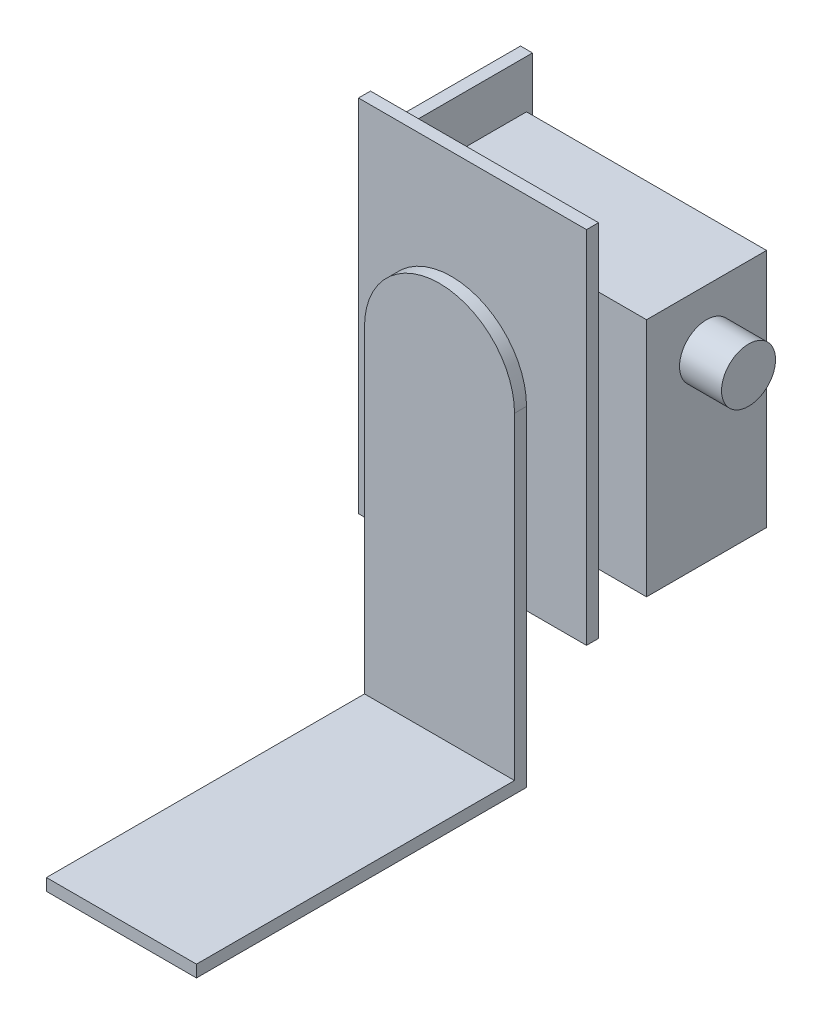
from build123d import *

# Parameters (mm, degrees)
ESQUISSE1_W        = 25
ESQUISSE1_H        = 55
BOSS_EXTRU_1_DEPTH = 2
ESQUISSE2_W        = 25
ESQUISSE2_H        = 2
BOSS_EXTRU_2_DEPTH = 53
BOSS_EXTRU_3_DEPTH = 2
ESQUISSE6_W        = 38
ESQUISSE6_H        = 60
BOSS_EXTRU_4_DEPTH = 2
ESQUISSE7_W        = 40
ESQUISSE7_H        = 40
BOSS_EXTRU_5_DEPTH = 20
ESQUISSE9_W        = 2
ESQUISSE9_H        = 40
BOSS_EXTRU_6_DEPTH = 25
ESQUISSE8_R        = 4.5
BOSS_EXTRU_7_DEPTH = 7


with BuildPart() as part:
    # Esquisse1 → Boss.-Extru.1 (new body)
    with BuildSketch(Plane(origin=(0, 0, 0), x_dir=(1, 0, 0), z_dir=(0, 1, 0))):
        with Locations((12.5, 27.5)):
            Rectangle(ESQUISSE1_W, ESQUISSE1_H)
    extrude(amount=BOSS_EXTRU_1_DEPTH)

    # Esquisse2 → Boss.-Extru.2 (add)
    with BuildSketch(Plane(origin=(0, 2, 0), x_dir=(1, 0, 0), z_dir=(0, 1, 0))):
        with Locations((12.5, 54)):
            Rectangle(ESQUISSE2_W, ESQUISSE2_H)
    extrude(amount=BOSS_EXTRU_2_DEPTH)

    # Esquisse3 → Boss.-Extru.3 (add)
    with BuildSketch(Plane.XY.offset(-53)):
        with BuildLine():
            Line((0, 2), (25, 2))
            Line((25, 2), (25, 55))
            ThreePointArc((25, 55), (12.5, 67.5), (0, 55))
            Line((0, 55), (0, 2))
        make_face()
    extrude(amount=-BOSS_EXTRU_3_DEPTH)

    # Esquisse6 → Boss.-Extru.4 (add)
    with BuildSketch(Plane(origin=(0, 0, -55), x_dir=(-1, 0, 0), z_dir=(0, 0, -1))):
        with Locations((-16, 55.5)):
            Rectangle(ESQUISSE6_W, ESQUISSE6_H)
    extrude(amount=BOSS_EXTRU_4_DEPTH)

    # Esquisse7 → Boss.-Extru.5 (add)
    with BuildSketch(Plane(origin=(0, 0, -57), x_dir=(-1, 0, 0), z_dir=(0, 0, -1))):
        with Locations((-23, 55.5)):
            Rectangle(ESQUISSE7_W, ESQUISSE7_H)
    extrude(amount=BOSS_EXTRU_5_DEPTH)

    # Esquisse9 → Boss.-Extru.6 (add)
    with BuildSketch(Plane(origin=(0, 0, -57), x_dir=(-1, 0, 0), z_dir=(0, 0, -1))):
        with Locations((2, 59.5)):
            Rectangle(ESQUISSE9_W, ESQUISSE9_H)
    extrude(amount=BOSS_EXTRU_6_DEPTH)

    # Esquisse8 → Boss.-Extru.7 (add)
    with BuildSketch(Plane(origin=(43, 0, 0), x_dir=(0, 0, -1), z_dir=(1, 0, 0))):
        with Locations(Location((67, 66, 0), (0, 0, 180))):
            Circle(ESQUISSE8_R)
    extrude(amount=BOSS_EXTRU_7_DEPTH)


solid = part.part
